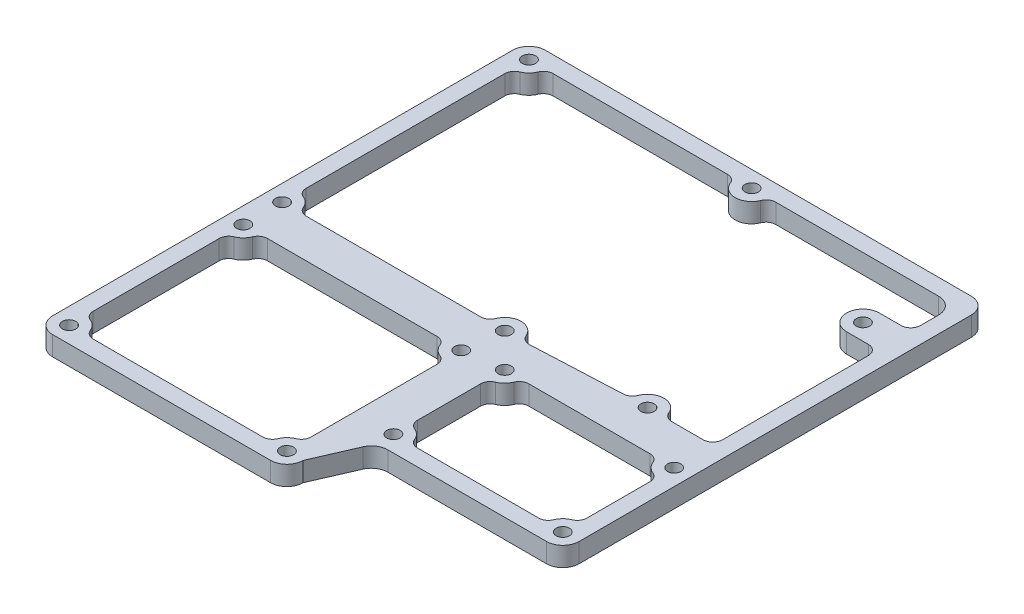
from build123d import *

# Parameters (mm, degrees)
SKETCH2_R                = 3.375
SKETCH2_R_2              = 1.375
PART_SCREWHOLES_DEPTH    = 4
PART_SCREWHOLES_2_DEPTH  = 4
PART_SCREWHOLES_3_DEPTH  = 4
PART_SCREWHOLES_4_DEPTH  = 4
PART_SCREWHOLES_5_DEPTH  = 4
PART_SCREWHOLES_6_DEPTH  = 4
PART_SCREWHOLES_7_DEPTH  = 4
PART_SCREWHOLES_8_DEPTH  = 4
PART_SCREWHOLES_9_DEPTH  = 4
PART_SCREWHOLES_10_DEPTH = 4
PART_SCREWHOLES_11_DEPTH = 4
PART_SCREWHOLES_12_DEPTH = 4
PART_SCREWHOLES_13_DEPTH = 4
PART_SCREWHOLES_14_DEPTH = 4
FRAME_START              = -4
SKETCH3_R                = 1.375
FRAME_DEPTH              = 4
GENERAL_ROUNDING_2MM_R   = 2


with BuildPart() as part:
    # Sketch2 → Part screwholes (new body)
    with BuildSketch(Plane(origin=(0, 0, 0), x_dir=(1, 0, 0), z_dir=(0, 1, 0))):
        with Locations(Location((-46, 51, 0), (0, 0, 270))):
            Circle(SKETCH2_R)
        with Locations(Location((-46, 51, 0), (0, 0, 270))):
            Circle(SKETCH2_R_2, mode=Mode.SUBTRACT)
    extrude(amount=PART_SCREWHOLES_DEPTH)



with BuildPart() as body_2:
    # Sketch2 → Part screwholes 2 (new body)
    with BuildSketch(Plane(origin=(0, 0, 0), x_dir=(1, 0, 0), z_dir=(0, 1, 0))):
        with Locations(Location((0, 51, 0), (0, 0, 270))):
            Circle(SKETCH2_R)
        with Locations(Location((0, 51, 0), (0, 0, 270))):
            Circle(SKETCH2_R_2, mode=Mode.SUBTRACT)
    extrude(amount=PART_SCREWHOLES_2_DEPTH)


with BuildPart() as body_3:
    # Sketch2 → Part screwholes 3 (new body)
    with BuildSketch(Plane(origin=(0, 0, 0), x_dir=(1, 0, 0), z_dir=(0, 1, 0))):
        with Locations(Location((0, 0, 0), (0, 0, 270))):
            Circle(SKETCH2_R)
        with Locations(Location((0, 0, 0), (0, 0, 270))):
            Circle(SKETCH2_R_2, mode=Mode.SUBTRACT)
    extrude(amount=PART_SCREWHOLES_3_DEPTH)


with BuildPart() as body_4:
    # Sketch2 → Part screwholes 4 (new body)
    with BuildSketch(Plane(origin=(0, 0, 0), x_dir=(1, 0, 0), z_dir=(0, 1, 0))):
        with Locations(Location((-46, 0, 0), (0, 0, 270))):
            Circle(SKETCH2_R)
        with Locations(Location((-46, 0, 0), (0, 0, 270))):
            Circle(SKETCH2_R_2, mode=Mode.SUBTRACT)
    extrude(amount=PART_SCREWHOLES_4_DEPTH)


with BuildPart() as body_5:
    # Sketch2 → Part screwholes 5 (new body)
    with BuildSketch(Plane(origin=(0, 0, 0), x_dir=(1, 0, 0), z_dir=(0, 1, 0))):
        with Locations(Location((-46, -8, 0), (0, 0, 270))):
            Circle(SKETCH2_R)
        with Locations(Location((-46, -8, 0), (0, 0, 270))):
            Circle(SKETCH2_R_2, mode=Mode.SUBTRACT)
    extrude(amount=PART_SCREWHOLES_5_DEPTH)


with BuildPart() as body_6:
    # Sketch2 → Part screwholes 6 (new body)
    with BuildSketch(Plane(origin=(0, 0, 0), x_dir=(1, 0, 0), z_dir=(0, 1, 0))):
        with Locations(Location((-1, -8, 0), (0, 0, 270))):
            Circle(SKETCH2_R)
        with Locations(Location((-1, -8, 0), (0, 0, 270))):
            Circle(SKETCH2_R_2, mode=Mode.SUBTRACT)
    extrude(amount=PART_SCREWHOLES_6_DEPTH)


with BuildPart() as body_7:
    # Sketch2 → Part screwholes 7 (new body)
    with BuildSketch(Plane(origin=(0, 0, 0), x_dir=(1, 0, 0), z_dir=(0, 1, 0))):
        with Locations(Location((7, -7, 0), (0, 0, 270))):
            Circle(SKETCH2_R)
        with Locations(Location((7, -7, 0), (0, 0, 270))):
            Circle(SKETCH2_R_2, mode=Mode.SUBTRACT)
    extrude(amount=PART_SCREWHOLES_7_DEPTH)


with BuildPart() as body_8:
    # Sketch2 → Part screwholes 8 (new body)
    with BuildSketch(Plane(origin=(0, 0, 0), x_dir=(1, 0, 0), z_dir=(0, 1, 0))):
        with Locations(Location((28.5, 1, 0), (0, 0, 270))):
            Circle(SKETCH2_R)
        with Locations(Location((28.5, 1, 0), (0, 0, 270))):
            Circle(SKETCH2_R_2, mode=Mode.SUBTRACT)
    extrude(amount=PART_SCREWHOLES_8_DEPTH)


with BuildPart() as body_9:
    # Sketch2 → Part screwholes 9 (new body)
    with BuildSketch(Plane(origin=(0, 0, 0), x_dir=(1, 0, 0), z_dir=(0, 1, 0))):
        with Locations(Location((35.5, 38.5, 0), (0, 0, 270))):
            Circle(SKETCH2_R)
        with Locations(Location((35.5, 38.5, 0), (0, 0, 270))):
            Circle(SKETCH2_R_2, mode=Mode.SUBTRACT)
    extrude(amount=PART_SCREWHOLES_9_DEPTH)


with BuildPart() as body_10:
    # Sketch2 → Part screwholes 10 (new body)
    with BuildSketch(Plane(origin=(0, 0, 0), x_dir=(1, 0, 0), z_dir=(0, 1, 0))):
        with Locations(Location((-1, -44, 0), (0, 0, 270))):
            Circle(SKETCH2_R)
        with Locations(Location((-1, -44, 0), (0, 0, 270))):
            Circle(SKETCH2_R_2, mode=Mode.SUBTRACT)
    extrude(amount=PART_SCREWHOLES_10_DEPTH)


with BuildPart() as body_11:
    # Sketch2 → Part screwholes 11 (new body)
    with BuildSketch(Plane(origin=(0, 0, 0), x_dir=(1, 0, 0), z_dir=(0, 1, 0))):
        with Locations(Location((-46, -44, 0), (0, 0, 270))):
            Circle(SKETCH2_R)
        with Locations(Location((-46, -44, 0), (0, 0, 270))):
            Circle(SKETCH2_R_2, mode=Mode.SUBTRACT)
    extrude(amount=PART_SCREWHOLES_11_DEPTH)


with BuildPart() as body_12:
    # Sketch2 → Part screwholes 12 (new body)
    with BuildSketch(Plane(origin=(0, 0, 0), x_dir=(1, 0, 0), z_dir=(0, 1, 0))):
        with Locations(Location((7, -30, 0), (0, 0, 270))):
            Circle(SKETCH2_R)
        with Locations(Location((7, -30, 0), (0, 0, 270))):
            Circle(SKETCH2_R_2, mode=Mode.SUBTRACT)
    extrude(amount=PART_SCREWHOLES_12_DEPTH)


with BuildPart() as body_13:
    # Sketch2 → Part screwholes 13 (new body)
    with BuildSketch(Plane(origin=(0, 0, 0), x_dir=(1, 0, 0), z_dir=(0, 1, 0))):
        with Locations(Location((42, -30, 0), (0, 0, 270))):
            Circle(SKETCH2_R)
        with Locations(Location((42, -30, 0), (0, 0, 270))):
            Circle(SKETCH2_R_2, mode=Mode.SUBTRACT)
    extrude(amount=PART_SCREWHOLES_13_DEPTH)


with BuildPart() as body_14:
    # Sketch2 → Part screwholes 14 (new body)
    with BuildSketch(Plane(origin=(0, 0, 0), x_dir=(1, 0, 0), z_dir=(0, 1, 0))):
        with Locations(Location((42, -7, 0), (0, 0, 270))):
            Circle(SKETCH2_R)
        with Locations(Location((42, -7, 0), (0, 0, 270))):
            Circle(SKETCH2_R_2, mode=Mode.SUBTRACT)
    extrude(amount=PART_SCREWHOLES_14_DEPTH)


with BuildPart() as part_1:
    add(part.part)

    add(body_2.part)  # Frame merges body 2

    add(body_3.part)  # Frame merges body 3

    add(body_4.part)  # Frame merges body 4

    add(body_5.part)  # Frame merges body 5

    add(body_6.part)  # Frame merges body 6

    add(body_7.part)  # Frame merges body 7

    add(body_8.part)  # Frame merges body 8

    add(body_9.part)  # Frame merges body 9

    add(body_10.part)  # Frame merges body 10

    add(body_11.part)  # Frame merges body 11

    add(body_12.part)  # Frame merges body 12

    add(body_13.part)  # Frame merges body 13

    add(body_14.part)  # Frame merges body 14
    # Sketch3 → Frame (add)
    with BuildSketch(Plane(origin=(0, 4, 0), x_dir=(1, 0, 0), z_dir=(0, 1, 0)).offset(FRAME_START)):
        with BuildLine():
            Line((-49.375, 51), (-49.375, -44))
            ThreePointArc((-49.375, -44), (-48.386485387, -46.386485387), (-46, -47.375))
            Line((-46, -47.375), (-1, -47.375))
            ThreePointArc((-1, -47.375), (1.386485387, -46.386485387), (2.375, -44))
            Line((2.375, -44), (6.117237342, -35.402968268))
            ThreePointArc((6.117237342, -35.402968268), (7.361851742, -33.927159489), (9.2117697, -33.375))
            Line((9.2117697, -33.375), (42, -33.375))
            ThreePointArc((42, -33.375), (44.386485387, -32.386485387), (45.375, -30))
            Line((45.375, -30), (45.375, 51))
            ThreePointArc((45.375, 51), (44.386485387, 53.386485387), (42, 54.375))
            Line((42, 54.375), (-46, 54.375))
            ThreePointArc((-46, 54.375), (-48.386485387, 53.386485387), (-49.375, 51))
        make_face()
        with Locations(Location((35.5, 38.5, 0), (0, 0, 270))):
            Circle(SKETCH3_R, mode=Mode.SUBTRACT)
        with Locations(Location((0, 51, 0), (0, 0, 270))):
            Circle(SKETCH3_R, mode=Mode.SUBTRACT)
        with Locations(Location((-46, 51, 0), (0, 0, 270))):
            Circle(SKETCH3_R, mode=Mode.SUBTRACT)
        with Locations(Location((-46, 0, 0), (0, 0, 270))):
            Circle(SKETCH3_R, mode=Mode.SUBTRACT)
        with Locations(Location((-46, -8, 0), (0, 0, 270))):
            Circle(SKETCH3_R, mode=Mode.SUBTRACT)
        with Locations(Location((0, 0, 0), (0, 0, 270))):
            Circle(SKETCH3_R, mode=Mode.SUBTRACT)
        with Locations(Location((-1, -8, 0), (0, 0, 270))):
            Circle(SKETCH3_R, mode=Mode.SUBTRACT)
        with Locations(Location((7, -7, 0), (0, 0, 270))):
            Circle(SKETCH3_R, mode=Mode.SUBTRACT)
        with Locations(Location((28.5, 1, 0), (0, 0, 270))):
            Circle(SKETCH3_R, mode=Mode.SUBTRACT)
        with Locations(Location((42, -7, 0), (0, 0, 270))):
            Circle(SKETCH3_R, mode=Mode.SUBTRACT)
        with Locations(Location((42, -30, 0), (0, 0, 270))):
            Circle(SKETCH3_R, mode=Mode.SUBTRACT)
        with Locations(Location((7, -30, 0), (0, 0, 270))):
            Circle(SKETCH3_R, mode=Mode.SUBTRACT)
        with Locations(Location((-46, -44, 0), (0, 0, 270))):
            Circle(SKETCH3_R, mode=Mode.SUBTRACT)
        with Locations(Location((-1, -44, 0), (0, 0, 270))):
            Circle(SKETCH3_R, mode=Mode.SUBTRACT)
        with BuildLine():
            Line((-46, 47.625), (-46, 3.375))
            ThreePointArc((-46, 3.375), (-43.613514613, 2.386485387), (-42.625, 0))
            Line((-42.625, 0), (-3.375, 0))
            ThreePointArc((-3.375, 0), (0, 3.375), (3.375, 0))
            Line((3.375, 0), (25.125, 1))
            ThreePointArc((25.125, 1), (28.5, 4.375), (31.875, 1))
            Line((31.875, 1), (42, 1))
            Line((42, 1), (42, 35.125))
            Line((42, 35.125), (35.5, 35.125))
            ThreePointArc((35.5, 35.125), (32.125, 38.5), (35.5, 41.875))
            Line((35.5, 41.875), (42, 41.875))
            Line((42, 41.875), (42, 47.625))
            ThreePointArc((42, 47.625), (41.011485387, 50.011485387), (38.625, 51))
            Line((38.625, 51), (3.375, 51))
            ThreePointArc((3.375, 51), (0, 47.625), (-3.375, 51))
            Line((-3.375, 51), (-42.625, 51))
            ThreePointArc((-42.625, 51), (-43.613514613, 48.613514613), (-46, 47.625))
        make_face(mode=Mode.SUBTRACT)
        with BuildLine():
            Line((-46, -11.375), (-46, -40.625))
            ThreePointArc((-46, -40.625), (-43.613514613, -41.613514613), (-42.625, -44))
            Line((-42.625, -44), (-4.375, -44))
            ThreePointArc((-4.375, -44), (-3.386485387, -41.613514613), (-1, -40.625))
            Line((-1, -40.625), (-1, -11.375))
            ThreePointArc((-1, -11.375), (-3.386485387, -10.386485387), (-4.375, -8))
            Line((-4.375, -8), (-42.625, -8))
            ThreePointArc((-42.625, -8), (-43.613514613, -10.386485387), (-46, -11.375))
        make_face(mode=Mode.SUBTRACT)
        with BuildLine():
            Line((10.375, -30), (38.625, -30))
            ThreePointArc((38.625, -30), (39.613514613, -27.613514613), (42, -26.625))
            Line((42, -26.625), (42, -10.375))
            ThreePointArc((42, -10.375), (39.613514613, -9.386485387), (38.625, -7))
            Line((38.625, -7), (10.375, -7))
            ThreePointArc((10.375, -7), (9.386485387, -9.386485387), (7, -10.375))
            Line((7, -10.375), (7, -26.625))
            ThreePointArc((7, -26.625), (9.386485387, -27.613514613), (10.375, -30))
        make_face(mode=Mode.SUBTRACT)
    extrude(amount=FRAME_DEPTH)

    # General rounding 2mm
    general_rounding_2mm_edges = [part_1.edges().sort_by_distance(p)[0] for p in [
        (-42.625, 2, 8),
        (-4.375, 2, 8),
        (-1, 2, 11.375),
        (-1, 2, 40.625),
        (-4.375, 2, 44),
        (-42.625, 2, 44),
        (-46, 2, 40.625),
        (-46, 2, 11.375),
        (42, 2, -35.125),
        (42, 2, -1),
        (31.875, 2, -1),
        (25.125, 2, -1),
        (3.375, 2, 0),
        (-3.375, 2, 0),
        (-42.625, 2, 0),
        (-46, 2, -3.375),
        (-46, 2, -47.625),
        (-42.625, 2, -51),
        (-3.375, 2, -51),
        (3.375, 2, -51),
        (42, 2, -41.875),
        (7, 2, 26.625),
        (7, 2, 10.375),
        (10.375, 2, 7),
        (38.625, 2, 7),
        (42, 2, 10.375),
        (42, 2, 26.625),
        (38.625, 2, 30),
        (10.375, 2, 30),
    ]]
    fillet(general_rounding_2mm_edges, radius=GENERAL_ROUNDING_2MM_R)


solid = part_1.part
